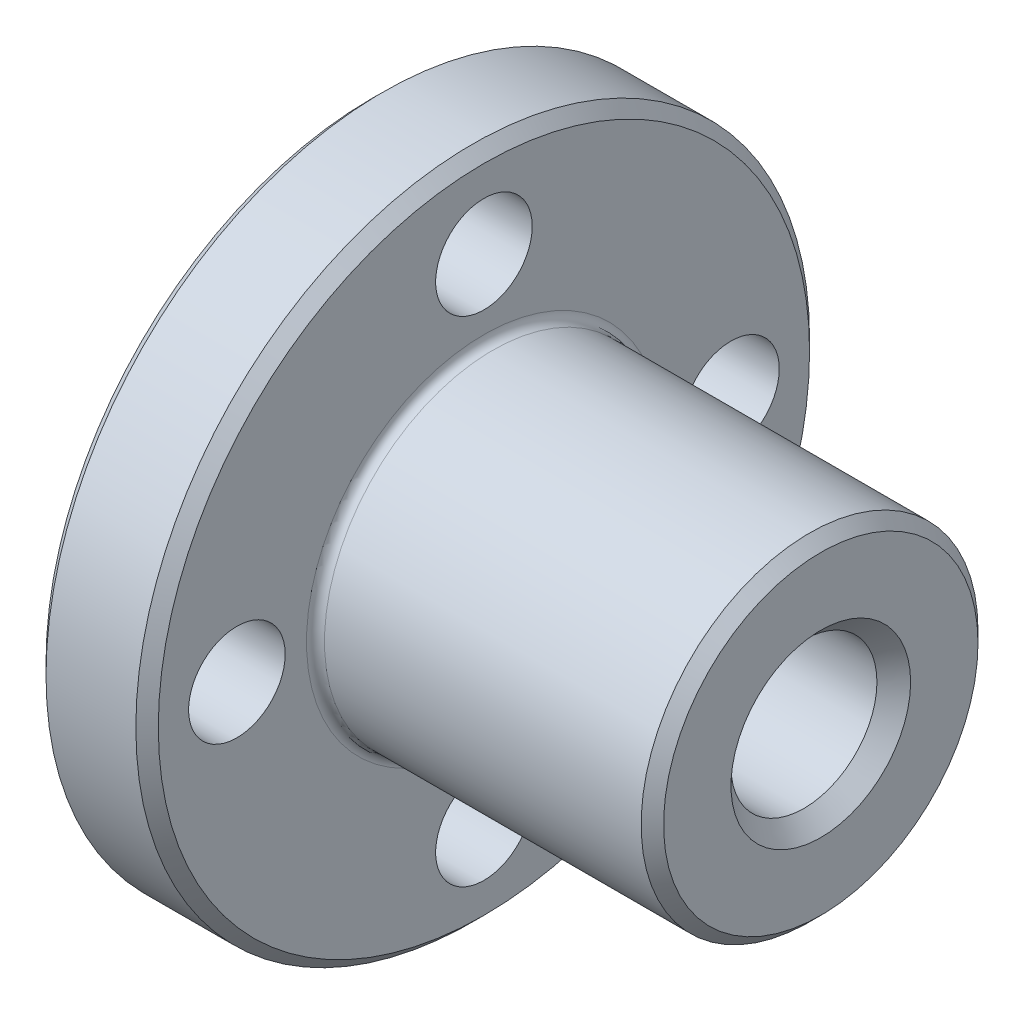
from build123d import *

# Parameters (mm, degrees)
SKETCH1_W                  = 5
SKETCH1_H                  = 15
SKETCH2_R                  = 7.5
BOSS_EXTRUDE1_DEPTH        = 15
F_4_3_4_3_DIAMETER_HOLE1_D = 4.3
F_6_5_6_5_DIAMETER_HOLE1_D = 6.5
CHAMFER1_SIZE              = 0.75
CHAMFER2_SIZE              = 0.5
FILLET1_R                  = 0.4


with BuildPart() as part:
    # Sketch1 → Revolve1 (revolve)
    with BuildSketch(Plane(origin=(0, 0, 0), x_dir=(-1, 0, 0), z_dir=(0, 0, -1)), mode=Mode.PRIVATE) as revolve1_sk:
        with Locations((-2.5, 7.5)):
            Rectangle(SKETCH1_W, SKETCH1_H)
    revolve(revolve1_sk.sketch.rotate(Axis((5, 0, 0), (-1, 0, 0)), 270), axis=Axis((5, 0, 0), (-1, 0, 0)))

    # Sketch2 → Boss-Extrude1 (add)
    with BuildSketch(Plane(origin=(5, 0, 0), x_dir=(0, 0, -1), z_dir=(1, 0, 0))):
        Circle(SKETCH2_R)
    extrude(amount=BOSS_EXTRUDE1_DEPTH)

    # Ø4.3 (4.3) Diameter Hole1 (through all)
    with Locations(Plane(origin=(5, 0, 0), x_dir=(0, 0, -1), z_dir=(1, 0, 0))):
        with Locations((-11, 0), (11, 0), (0, -11), (0, 11)):
            Hole(F_4_3_4_3_DIAMETER_HOLE1_D / 2)

    # Ø6.5 (6.5) Diameter Hole1 (through all)
    with Locations(Plane.ZY):
        with Locations((0, 0)):
            Hole(F_6_5_6_5_DIAMETER_HOLE1_D / 2)

    # Chamfer1
    chamfer1_edges = [part.edges().sort_by_distance(p)[0] for p in [
        (0, 0, 3.25),
        (20, 0, 3.25),
    ]]
    chamfer(chamfer1_edges, length=CHAMFER1_SIZE)

    # Chamfer2
    chamfer2_edges = [part.edges().sort_by_distance(p)[0] for p in [
        (0, 0, -15),
        (5, 0, -15),
        (20, 0, 7.5),
    ]]
    chamfer(chamfer2_edges, length=CHAMFER2_SIZE)

    # Fillet1
    fillet1_edges = [part.edges().sort_by_distance(p)[0] for p in [
        (5, 0, 7.5),
    ]]
    fillet(fillet1_edges, radius=FILLET1_R)


solid = part.part
